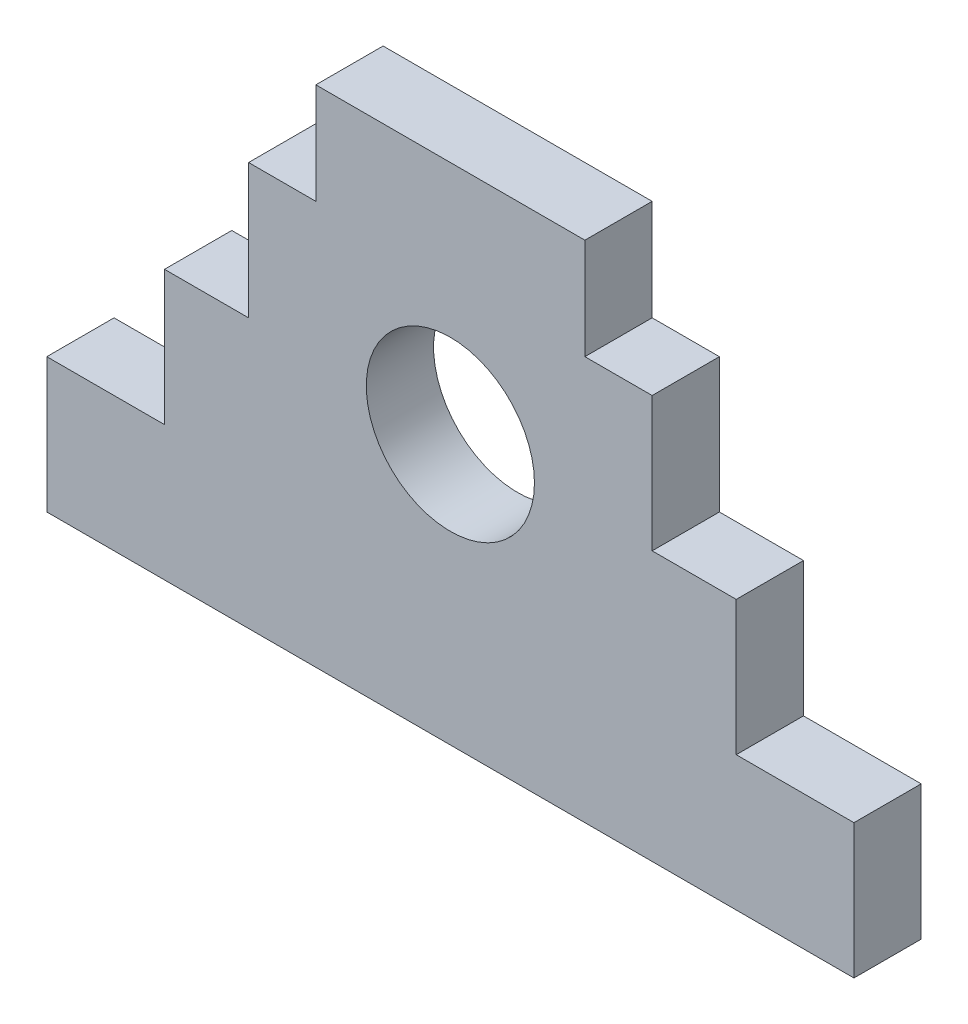
from build123d import *

# Parameters (mm, degrees)
SKETCH1_R           = 7.9375
BOSS_EXTRUDE1_DEPTH = 6.35


with BuildPart() as part:
    # Sketch1 → Boss-Extrude1 (new body)
    with BuildSketch(Plane.XY):
        Polygon((0, 0), (11.1125, 0), (11.1125, 12.7), (19.05, 12.7), (19.05, 25.4), (25.4, 25.4), (25.4, 34.925), (50.8, 34.925), (50.8, 25.4), (57.15, 25.4), (57.15, 12.7), (65.0875, 12.7), (65.0875, 0), (76.2, 0), (76.2, -12.7), (0, -12.7), align=None)
        with Locations((38.1, 12.7)):
            Circle(SKETCH1_R, mode=Mode.SUBTRACT)
    extrude(amount=BOSS_EXTRUDE1_DEPTH)


solid = part.part
